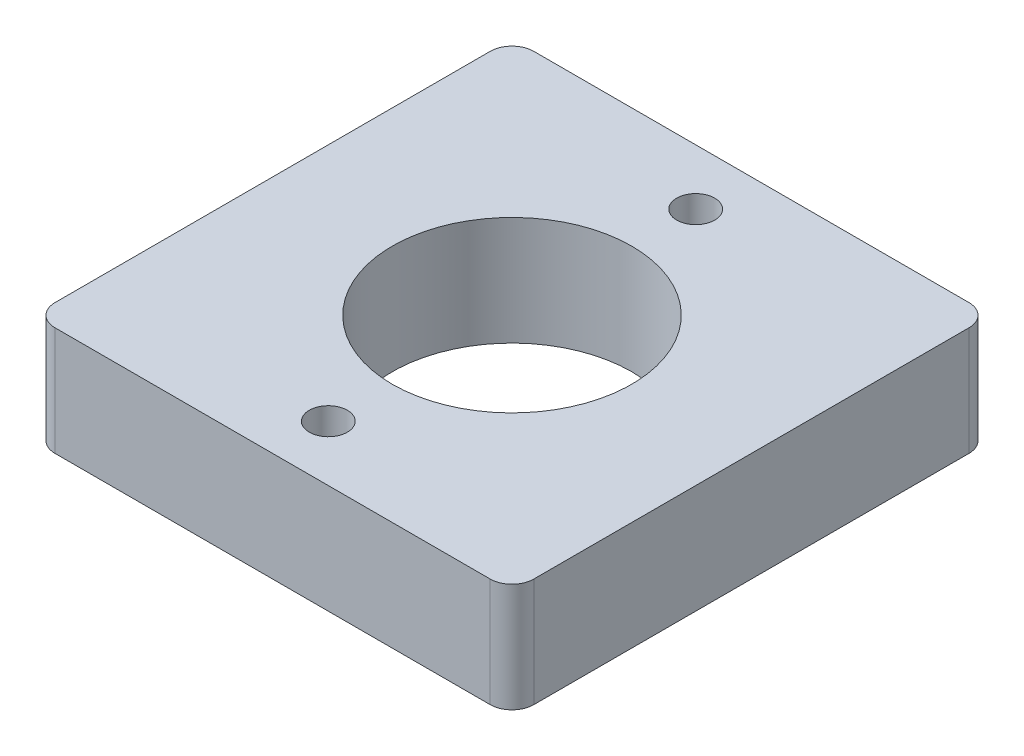
from build123d import *

# Parameters (mm, degrees)
CROQUIS1_W              = 44
CROQUIS1_H              = 44
CROQUIS1_R              = 11
SALIENTE_EXTRUIR1_DEPTH = 10
CROQUIS2_R              = 1.75
CORTAR_EXTRUIR1_DEPTH   = 33.680269277
REDONDEO1_R             = 2


with BuildPart() as part:
    # Croquis1 → Saliente-Extruir1 (new body)
    with BuildSketch(Plane(origin=(0, 0, 0), x_dir=(1, 0, 0), z_dir=(0, 1, 0))):
        Rectangle(CROQUIS1_W, CROQUIS1_H)
        with Locations(Location((0, 0, 0), (0, 0, 270))):
            Circle(CROQUIS1_R, mode=Mode.SUBTRACT)
    extrude(amount=SALIENTE_EXTRUIR1_DEPTH)

    # Croquis2 → Cortar-Extruir1 (cut, through all)
    with BuildSketch(Plane(origin=(0, 10, 0), x_dir=(1, 0, 0), z_dir=(0, 1, 0))):
        with Locations(Location((0, 16.88, 0), (0, 0, 270))):
            Circle(CROQUIS2_R)
        with Locations(Location((0, -16.88, 0), (0, 0, 270))):
            Circle(CROQUIS2_R)
    extrude(amount=-CORTAR_EXTRUIR1_DEPTH, mode=Mode.SUBTRACT)

    # Redondeo1
    redondeo1_edges = [part.edges().sort_by_distance(p)[0] for p in [
        (22, 5, 22),
        (-22, 5, 22),
        (-22, 5, -22),
        (22, 5, -22),
    ]]
    fillet(redondeo1_edges, radius=REDONDEO1_R)


solid = part.part
